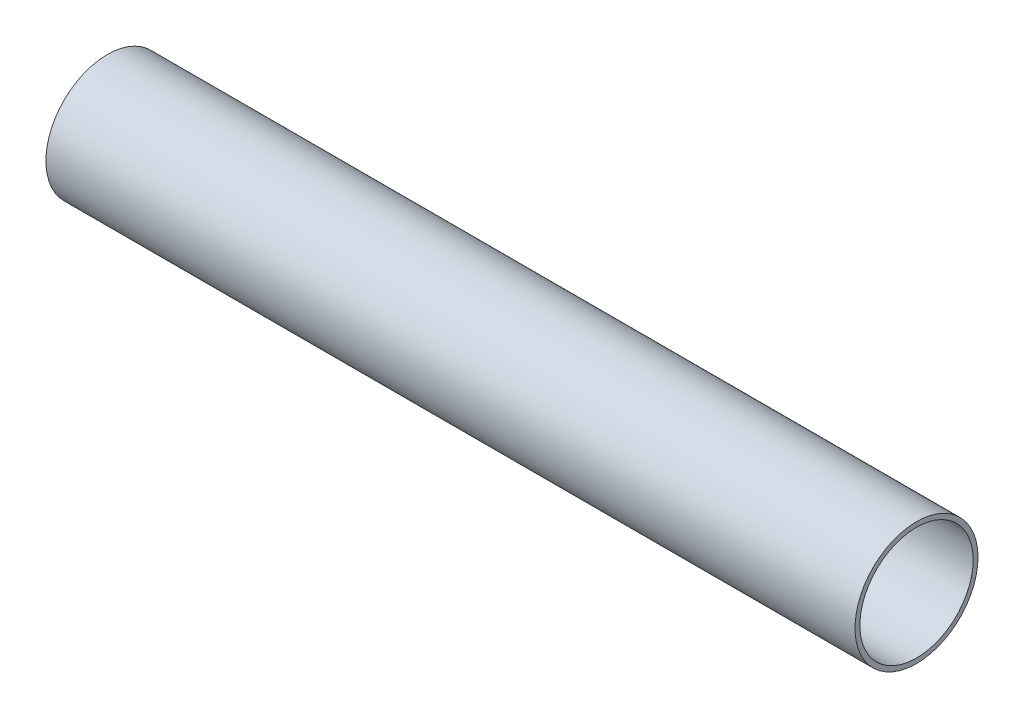
from build123d import *

# Parameters (mm, degrees)
CROQUIS1_R              = 57
CROQUIS1_R_2            = 52.5
SALIENTE_EXTRUIR1_DEPTH = 750


with BuildPart() as part:
    # Croquis1 → Saliente-Extruir1 (new body)
    with BuildSketch(Plane(origin=(0, 0, 0), x_dir=(0, 0, -1), z_dir=(1, 0, 0))):
        Circle(CROQUIS1_R)
        Circle(CROQUIS1_R_2, mode=Mode.SUBTRACT)
    extrude(amount=SALIENTE_EXTRUIR1_DEPTH)


solid = part.part
